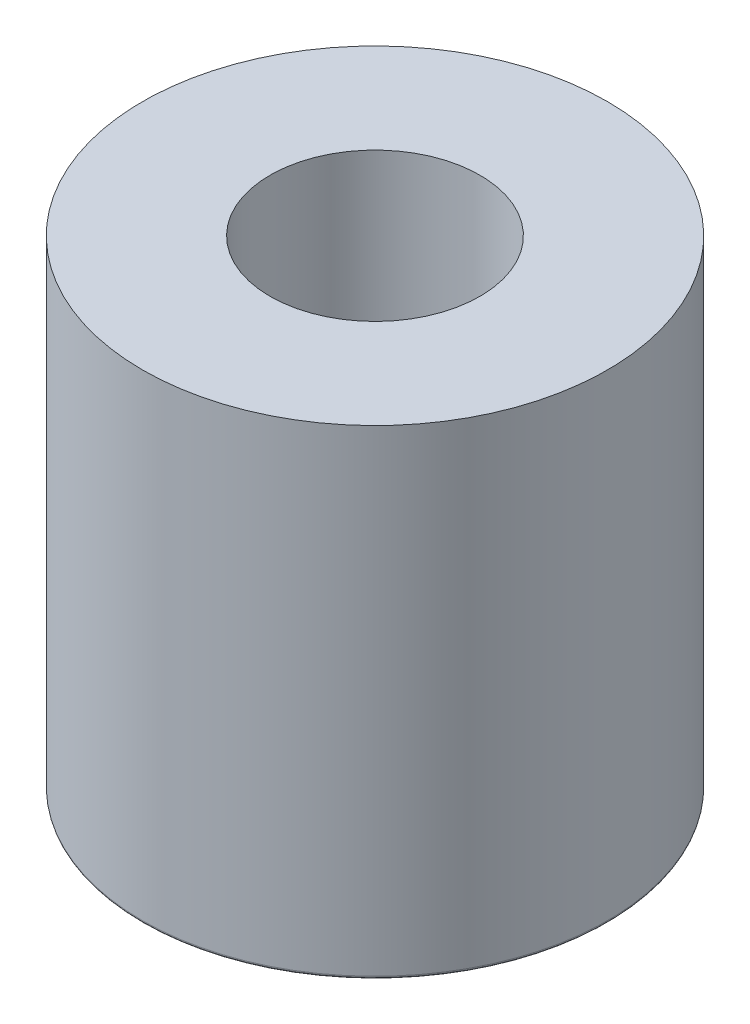
from build123d import *

# Parameters (mm, degrees)
SKETCH1_R            = 3
BOSS_EXTRUDE1_DEPTH  = 4.5
SKETCH2_R            = 4
BOSS_EXTRUDE3_DEPTH  = 5.7
SKETCH3_R            = 3.875
BOSS_EXTRUDE4_DEPTH  = 6
SKETCH4_R            = 1.75
CUT_EXTRUDE1_DEPTH   = 15
SKETCH27_W           = 0.2
SKETCH27_H           = 2
BOSS_EXTRUDE11_DEPTH = 0.1
SKETCH28_W           = 2
SKETCH28_H           = 0.32
SKETCH28_W_2         = 0.260444828
SKETCH28_H_2         = 2
CUT_EXTRUDE12_DEPTH  = 2
SKETCH30_R           = 0.75
BOSS_EXTRUDE12_DEPTH = 0.25
FILLET1_R            = 0.05


with BuildPart() as part:
    # Sketch1 → Boss-Extrude1 (new body)
    with BuildSketch(Plane(origin=(0, 0, 0), x_dir=(1, 0, 0), z_dir=(0, 1, 0))):
        with Locations(Location((0, 0, 0), (0, 0, 270))):
            Circle(SKETCH1_R)
    extrude(amount=BOSS_EXTRUDE1_DEPTH)

    # Sketch2 → Boss-Extrude3 (add)
    with BuildSketch(Plane.XZ):
        with Locations(Location((0, 0, 0), (0, 0, 270))):
            Circle(SKETCH2_R)
    extrude(amount=BOSS_EXTRUDE3_DEPTH)

    # Sketch3 → Boss-Extrude4 (add)
    with BuildSketch(Plane.XZ.offset(5.7)):
        with Locations(Location((0, 0, 0), (0, 0, 270))):
            Circle(SKETCH3_R)
    extrude(amount=BOSS_EXTRUDE4_DEPTH)

    # Sketch4 → Cut-Extrude1 (cut)
    with BuildSketch(Plane(origin=(0, 4.5, 0), x_dir=(1, 0, 0), z_dir=(0, 1, 0))):
        with Locations(Location((0, 0, 0), (0, 0, 270))):
            Circle(SKETCH4_R)
    extrude(amount=-CUT_EXTRUDE1_DEPTH, mode=Mode.SUBTRACT)

    # Sketch27 → Boss-Extrude11 (add)
    with BuildSketch(Plane.XZ.offset(11.7)):
        with Locations((2.8, 0)):
            Rectangle(SKETCH27_W, SKETCH27_H)
        with Locations((2.339555172, 0)):
            Rectangle(SKETCH27_W, SKETCH27_H)
        with Locations((-2.339555172, 0)):
            Rectangle(SKETCH27_W, SKETCH27_H)
        with Locations((-2.8, 0)):
            Rectangle(SKETCH27_W, SKETCH27_H)
        with BuildLine():
            Line((-1.908396934, -0.943010701), (-1.908396934, -0.761683842))
            Line((-1.908396934, -0.761683842), (-1.838655835, -0.761683842))
            Line((-1.838655835, -0.761683842), (-1.838655835, -0.776503826))
            Line((-1.838655835, -0.776503826), (-1.838655835, -0.830771119))
            add(Edge.make_bspline(
                [(-1.838655835, -0.830771119), (-1.838021547, -0.835916193), (-1.836810122, -0.84574276), (-1.831239264, -0.859153688), (-1.823718107, -0.870971548), (-1.816538568, -0.876711781), (-1.812938804, -0.879589889)],
                knots=[0, 0, 0, 0, 1.086961345, 2.075985289, 3.035314294, 4, 4, 4, 4], degree=3))
            add(Edge.make_bspline(
                [(-1.812938804, -0.879589889), (-1.807197469, -0.883553117), (-1.795673797, -0.891507875), (-1.777056112, -0.901422138), (-1.757611843, -0.909973641), (-1.737267891, -0.916954625), (-1.716058386, -0.922383654), (-1.693927517, -0.926386741), (-1.670808067, -0.928456453), (-1.655080396, -0.928858244), (-1.647085752, -0.929062481)],
                knots=[0, 0, 0, 0, 0.950794876, 1.908379761, 2.871127693, 3.84558135, 4.838051937, 5.854515109, 6.909413221, 8, 8, 8, 8], degree=3))
            add(Edge.make_bspline(
                [(-1.647085752, -0.929062481), (-1.639293233, -0.928910482), (-1.624049824, -0.928613147), (-1.601809485, -0.924582791), (-1.580553112, -0.918946859), (-1.560650123, -0.910270037), (-1.541881954, -0.899431027), (-1.52408284, -0.886381737), (-1.507818369, -0.870457949), (-1.492548461, -0.852656017), (-1.478817925, -0.832788909), (-1.466937581, -0.811185656), (-1.456516224, -0.788152961), (-1.448342065, -0.763515049), (-1.442029559, -0.737402074), (-1.437518578, -0.709865547), (-1.434566736, -0.680819345), (-1.434296001, -0.660929981), (-1.434157457, -0.650751905)],
                knots=[0, 0, 0, 0, 0.951078584, 1.860461359, 2.754456427, 3.633511994, 4.504639864, 5.399648457, 6.322754807, 7.280029946, 8.262743676, 9.268295822, 10.289716263, 11.348243062, 12.435753816, 13.569926378, 14.756447268, 16, 16, 16, 16], degree=3))
            add(Edge.make_bspline(
                [(-1.434157457, -0.650751905), (-1.434306261, -0.640566361), (-1.434595383, -0.620776264), (-1.438580046, -0.592007726), (-1.444200831, -0.56483566), (-1.452862965, -0.539490895), (-1.463493336, -0.515740442), (-1.476715476, -0.493706921), (-1.492397245, -0.473464666), (-1.510464949, -0.455065867), (-1.530383529, -0.43847725), (-1.552461885, -0.424339702), (-1.576049431, -0.411912379), (-1.601820273, -0.402269075), (-1.629253141, -0.394308728), (-1.658616939, -0.38901978), (-1.689722979, -0.385652639), (-1.711078408, -0.385275695), (-1.722057434, -0.385081904)],
                knots=[0, 0, 0, 0, 1.099532391, 2.136346529, 3.132402078, 4.09294242, 5.023778189, 5.93909755, 6.862224401, 7.783581112, 8.720189817, 9.656305093, 10.611152675, 11.595042726, 12.623564843, 13.693451414, 14.814181828, 16, 16, 16, 16], degree=3))
            Line((-1.722057434, -0.385081904), (-1.810759395, -0.385081904))
            Line((-1.810759395, -0.385081904), (-1.810759395, -0.343237244))
            Line((-1.810759395, -0.343237244), (-1.765209739, -0.343237244))
            add(Edge.make_bspline(
                [(-1.765209739, -0.343237244), (-1.752998571, -0.343102125), (-1.729339965, -0.342840337), (-1.695212452, -0.339928256), (-1.663579195, -0.335485783), (-1.634644745, -0.328989338), (-1.608190922, -0.320742593), (-1.584418679, -0.310574856), (-1.563161165, -0.298495532), (-1.544463872, -0.284457138), (-1.528012028, -0.268334598), (-1.514130541, -0.249869425), (-1.502079898, -0.229317386), (-1.492764276, -0.206331821), (-1.484900774, -0.181312208), (-1.47997467, -0.15392597), (-1.476546412, -0.124438906), (-1.47618749, -0.104021817), (-1.476002117, -0.093476931)],
                knots=[0, 0, 0, 0, 1.326177627, 2.569411233, 3.717833407, 4.793796475, 5.787145267, 6.723897738, 7.597025505, 8.436701517, 9.257018564, 10.090403663, 10.939080149, 11.837519171, 12.778616236, 13.783093849, 14.85502659, 16, 16, 16, 16], degree=3))
            add(Edge.make_bspline(
                [(-1.476002117, -0.093476931), (-1.476078632, -0.084389663), (-1.476227062, -0.066761662), (-1.478765722, -0.04122112), (-1.482439234, -0.017425105), (-1.48722232, 0.004696519), (-1.494195665, 0.024869784), (-1.502065114, 0.043467257), (-1.511752165, 0.060214239), (-1.522939667, 0.075070847), (-1.535427641, 0.088439117), (-1.549773508, 0.099662846), (-1.56520781, 0.109614745), (-1.582308979, 0.117527471), (-1.600837402, 0.123547317), (-1.620840029, 0.127897868), (-1.642292776, 0.130541295), (-1.657103229, 0.130845432), (-1.664738968, 0.131002233)],
                knots=[0, 0, 0, 0, 1.298576519, 2.519052765, 3.664770883, 4.740572896, 5.748834366, 6.711621253, 7.623665698, 8.506443527, 9.365943911, 10.230449435, 11.103459615, 11.986237445, 12.915678043, 13.883325969, 14.908718741, 16, 16, 16, 16], degree=3))
            add(Edge.make_bspline(
                [(-1.664738968, 0.131002233), (-1.67784524, 0.130526544), (-1.703438858, 0.12959763), (-1.740732634, 0.122761472), (-1.775666181, 0.111132669), (-1.796953621, 0.099640541), (-1.807490281, 0.093952274)],
                knots=[0, 0, 0, 0, 1.053593617, 2.057432638, 3.038486015, 4, 4, 4, 4], degree=3))
            add(Edge.make_bspline(
                [(-1.807490281, 0.093952274), (-1.810088501, 0.092210607), (-1.814950991, 0.088951131), (-1.821101998, 0.083139695), (-1.825492509, 0.076837637), (-1.827957847, 0.070864107), (-1.82896566, 0.064898921), (-1.830118265, 0.058383038), (-1.831140929, 0.049648596), (-1.83216549, 0.038811152), (-1.833497444, 0.025881893), (-1.83506575, 0.010855197), (-1.836567109, -0.00636584), (-1.837505226, -0.01857699), (-1.838002012, -0.025043477)],
                knots=[0, 0, 0, 0, 0.879812501, 1.646542448, 2.36713564, 3.028064192, 3.445270561, 4.067391947, 4.891968434, 5.919830777, 7.132913586, 8.551568617, 10.17386271, 12, 12, 12, 12], degree=3))
            Line((-1.838002012, -0.025043477), (-1.838655835, -0.036376406))
            Line((-1.838655835, -0.036376406), (-1.908396934, -0.036376406))
            Line((-1.908396934, -0.036376406), (-1.908396934, 0.131002233))
            add(Edge.make_bspline(
                [(-1.908396934, 0.131002233), (-1.898550001, 0.13437677), (-1.878646983, 0.141197519), (-1.847908762, 0.149565652), (-1.816215174, 0.156811768), (-1.783553892, 0.162648666), (-1.74996162, 0.167226055), (-1.715425458, 0.170473678), (-1.67994622, 0.172480178), (-1.65595134, 0.172723726), (-1.643816638, 0.172846893)],
                knots=[0, 0, 0, 0, 0.92788875, 1.875486081, 2.838716749, 3.825932113, 4.832674024, 5.860695322, 6.918109807, 8, 8, 8, 8], degree=3))
            add(Edge.make_bspline(
                [(-1.643816638, 0.172846893), (-1.631753181, 0.172615356), (-1.608167877, 0.172162677), (-1.573747833, 0.169292393), (-1.541349636, 0.163586566), (-1.510746208, 0.15674302), (-1.482309856, 0.146968928), (-1.455716928, 0.135420802), (-1.431009593, 0.12176997), (-1.408574864, 0.105737441), (-1.388236965, 0.088249419), (-1.370682213, 0.068871319), (-1.355689517, 0.048108316), (-1.34366719, 0.025637126), (-1.334181351, 0.001658913), (-1.327558924, -0.023889029), (-1.323210204, -0.050903055), (-1.322787675, -0.069413302), (-1.322571697, -0.078874888)],
                knots=[0, 0, 0, 0, 1.258520905, 2.460538288, 3.597972764, 4.687969455, 5.728008804, 6.729052755, 7.709461579, 8.666154017, 9.600741666, 10.501983938, 11.387315295, 12.265482606, 13.153437077, 14.070658611, 15.013809414, 16, 16, 16, 16], degree=3))
            add(Edge.make_bspline(
                [(-1.322571697, -0.078874888), (-1.322721978, -0.086875425), (-1.323016545, -0.102557474), (-1.325847694, -0.125620899), (-1.329727078, -0.147863886), (-1.336077699, -0.16913008), (-1.343596679, -0.189680622), (-1.352968934, -0.209332841), (-1.364240242, -0.228013573), (-1.377125732, -0.245816969), (-1.391463512, -0.263032), (-1.408057724, -0.278794585), (-1.425904751, -0.294264449), (-1.445797144, -0.308484139), (-1.467225192, -0.322085615), (-1.490447204, -0.334751226), (-1.515442732, -0.34646662), (-1.532919728, -0.353424213), (-1.541820279, -0.356967523)],
                knots=[0, 0, 0, 0, 1.010174578, 1.980067854, 2.9322583, 3.858806069, 4.779334862, 5.694725609, 6.604440247, 7.531533258, 8.469240029, 9.429752861, 10.419204571, 11.450869805, 12.515124691, 13.624026854, 14.789982478, 16, 16, 16, 16], degree=3))
            add(Edge.make_bspline(
                [(-1.541820279, -0.356967523), (-1.530525942, -0.359973096), (-1.508573741, -0.365814867), (-1.477131497, -0.376285638), (-1.44823989, -0.387859744), (-1.421669244, -0.399927541), (-1.397778261, -0.413293344), (-1.376381103, -0.427609443), (-1.357500245, -0.442950495), (-1.340897058, -0.459206508), (-1.326505479, -0.476859539), (-1.314286596, -0.496238375), (-1.303807991, -0.517176081), (-1.295299201, -0.539750294), (-1.288774516, -0.563996694), (-1.284029397, -0.589865309), (-1.281149709, -0.617414207), (-1.28087022, -0.63628806), (-1.280727038, -0.645957205)],
                knots=[0, 0, 0, 0, 1.307709712, 2.541725736, 3.705678368, 4.789627241, 5.805103324, 6.765658399, 7.667149594, 8.523715164, 9.361715189, 10.209711591, 11.08229269, 11.977677995, 12.904617173, 13.888456662, 14.918248446, 16, 16, 16, 16], degree=3))
            add(Edge.make_bspline(
                [(-1.280727038, -0.645957205), (-1.281011775, -0.658102889), (-1.281569724, -0.681902619), (-1.286170963, -0.716593579), (-1.293912579, -0.749314883), (-1.304147598, -0.780243586), (-1.318199718, -0.808941347), (-1.334690037, -0.836044305), (-1.354747009, -0.860869644), (-1.377378491, -0.883824094), (-1.402732401, -0.904267957), (-1.430284624, -0.922255285), (-1.460113676, -0.937345636), (-1.492145221, -0.949519185), (-1.526288572, -0.959096117), (-1.562512783, -0.966024696), (-1.600926435, -0.970261545), (-1.627241901, -0.97068799), (-1.640765464, -0.970907141)],
                knots=[0, 0, 0, 0, 1.063396629, 2.083748558, 3.057496812, 4.005101803, 4.929900845, 5.849762909, 6.777773259, 7.718002778, 8.667890207, 9.624317239, 10.594546725, 11.589390339, 12.620593392, 13.696138762, 14.816041693, 16, 16, 16, 16], degree=3))
            add(Edge.make_bspline(
                [(-1.640765464, -0.970907141), (-1.665547803, -0.970590031), (-1.713572744, -0.969975513), (-1.783078247, -0.964768651), (-1.84765939, -0.956029439), (-1.888609394, -0.947252045), (-1.908396934, -0.943010701)],
                knots=[0, 0, 0, 0, 1.102689383, 2.136868281, 3.099712061, 4, 4, 4, 4], degree=3))
        make_face()
        with BuildLine():
            Line((1.285745429, -0.943010701), (1.285745429, -0.871090192))
            add(Edge.make_bspline(
                [(1.285745429, -0.871090192), (1.290817697, -0.855922684), (1.300862472, -0.825885981), (1.318549399, -0.782265171), (1.338421607, -0.740493709), (1.360496544, -0.700598242), (1.384418732, -0.662405973), (1.410483422, -0.626097087), (1.438544309, -0.591486708), (1.459007071, -0.569982657), (1.469251698, -0.559216712)],
                knots=[0, 0, 0, 0, 1.050700464, 2.080735854, 3.090676239, 4.088449864, 5.075142831, 6.050126928, 7.023801348, 8, 8, 8, 8], degree=3))
            Line((1.469251698, -0.559216712), (1.547710435, -0.485770617))
            add(Edge.make_bspline(
                [(1.547710435, -0.485770617), (1.558566619, -0.475560978), (1.579564482, -0.455813652), (1.609365802, -0.426758604), (1.636252122, -0.39914908), (1.6605068, -0.373387401), (1.681644475, -0.348952816), (1.699961591, -0.326221502), (1.715864536, -0.305447257), (1.728765548, -0.285556615), (1.739740403, -0.266256293), (1.748911677, -0.246575598), (1.756566149, -0.226153986), (1.762835967, -0.205023667), (1.767935204, -0.183208884), (1.77130224, -0.160683477), (1.773639902, -0.137477707), (1.773834317, -0.121742684), (1.773933127, -0.113745438)],
                knots=[0, 0, 0, 0, 1.588062519, 3.071606111, 4.434729839, 5.694510104, 6.841517844, 7.876435956, 8.805403746, 9.627779299, 10.400757042, 11.169614695, 11.938861978, 12.722618816, 13.516970778, 14.32389783, 15.148129558, 16, 16, 16, 16], degree=3))
            add(Edge.make_bspline(
                [(1.773933127, -0.113745438), (1.773769741, -0.104731571), (1.773450154, -0.087100235), (1.770843417, -0.061369211), (1.766356383, -0.037014188), (1.760776921, -0.013909912), (1.752610948, 0.007598774), (1.743485651, 0.028017323), (1.731925536, 0.046750913), (1.719187534, 0.064247349), (1.704860661, 0.07989689), (1.68924603, 0.093500113), (1.672658689, 0.105186418), (1.654812956, 0.114557175), (1.635935057, 0.122112202), (1.615859276, 0.127245575), (1.594665734, 0.130369231), (1.580194712, 0.130787656), (1.572773643, 0.131002233)],
                knots=[0, 0, 0, 0, 1.214385169, 2.375366155, 3.479367376, 4.550061153, 5.571993571, 6.574904148, 7.558619874, 8.531612115, 9.487667638, 10.410319034, 11.317260121, 12.214909893, 13.1201062, 14.050770688, 15.000390762, 16, 16, 16, 16], degree=3))
            add(Edge.make_bspline(
                [(1.572773643, 0.131002233), (1.564558218, 0.130827696), (1.548455201, 0.130485586), (1.524790945, 0.128005969), (1.502037171, 0.124158381), (1.480209296, 0.118537632), (1.459517101, 0.11101856), (1.439693084, 0.102307518), (1.420850107, 0.091918984), (1.40923876, 0.0835396), (1.403433535, 0.079350232)],
                knots=[0, 0, 0, 0, 1.093988183, 2.144321298, 3.165507317, 4.165200079, 5.141442069, 6.094343835, 7.047245601, 8, 8, 8, 8], degree=3))
            add(Edge.make_bspline(
                [(1.403433535, 0.079350232), (1.401209509, 0.077264462), (1.396261358, 0.072623912), (1.39085434, 0.062454748), (1.38556733, 0.049596568), (1.381528162, 0.03331899), (1.377547234, 0.014150332), (1.374380978, -0.008202729), (1.3717883, -0.033648466), (1.370675555, -0.051699564), (1.370088572, -0.061221672)],
                knots=[0, 0, 0, 0, 0.494504152, 1.100203551, 1.855075106, 2.763546905, 3.828066112, 5.049912925, 6.443803704, 8, 8, 8, 8], degree=3))
            Line((1.370088572, -0.061221672), (1.369434749, -0.078221066))
            Line((1.369434749, -0.078221066), (1.299693649, -0.078221066))
            Line((1.299693649, -0.078221066), (1.299693649, 0.103105794))
            add(Edge.make_bspline(
                [(1.299693649, 0.103105794), (1.312721133, 0.108676405), (1.338345704, 0.119633588), (1.376870396, 0.133665232), (1.414492468, 0.145806353), (1.451370052, 0.155641723), (1.487456606, 0.16327022), (1.522734089, 0.168772479), (1.557159215, 0.172188715), (1.579885642, 0.172629676), (1.591080681, 0.172846893)],
                knots=[0, 0, 0, 0, 1.126844811, 2.216461464, 3.259975363, 4.270602231, 5.25095513, 6.192474031, 7.109612608, 8, 8, 8, 8], degree=3))
            add(Edge.make_bspline(
                [(1.591080681, 0.172846893), (1.603075001, 0.172577223), (1.626613451, 0.172048005), (1.6611357, 0.168441945), (1.693962209, 0.161757778), (1.725249898, 0.152966795), (1.75474905, 0.141302604), (1.782742424, 0.127352069), (1.808847321, 0.110462347), (1.833207838, 0.091413566), (1.855122756, 0.070327136), (1.874512822, 0.047780231), (1.89091616, 0.023749524), (1.904391701, -0.001736747), (1.914574646, -0.028721547), (1.922085037, -0.057034069), (1.926458262, -0.086802625), (1.927058415, -0.107120431), (1.927363546, -0.117450434)],
                knots=[0, 0, 0, 0, 1.157424332, 2.271406417, 3.343739353, 4.38656673, 5.403242917, 6.40017594, 7.399668867, 8.398153384, 9.37981207, 10.329487603, 11.262773791, 12.181519608, 13.104561084, 14.039740884, 15.003362774, 16, 16, 16, 16], degree=3))
            add(Edge.make_bspline(
                [(1.927363546, -0.117450434), (1.927177392, -0.124503273), (1.926805955, -0.138575947), (1.924377561, -0.159577885), (1.920221024, -0.180350705), (1.914314049, -0.200905884), (1.90662216, -0.221189762), (1.897362959, -0.241308903), (1.886777894, -0.261481491), (1.874006666, -0.281210063), (1.859819031, -0.300847352), (1.844096076, -0.320397936), (1.826390107, -0.339455523), (1.807099713, -0.358399732), (1.786507389, -0.377554793), (1.763658714, -0.395779542), (1.739740278, -0.414617865), (1.722712188, -0.426364598), (1.71399937, -0.432375087)],
                knots=[0, 0, 0, 0, 0.854554074, 1.705109362, 2.55789356, 3.41877106, 4.293443476, 5.183657085, 6.101173272, 7.051052993, 8.028272964, 9.035940767, 10.088733311, 11.177986928, 12.311886033, 13.494190071, 14.717844033, 16, 16, 16, 16], degree=3))
            Line((1.71399937, -0.432375087), (1.630745932, -0.494706195))
            add(Edge.make_bspline(
                [(1.630745932, -0.494706195), (1.614782308, -0.506959249), (1.583845168, -0.530705388), (1.542096786, -0.569227964), (1.505937277, -0.608468121), (1.475317006, -0.648486184), (1.450433266, -0.689439492), (1.431302326, -0.731233361), (1.417810219, -0.773943377), (1.413449163, -0.803013486), (1.411279409, -0.817476722)],
                knots=[0, 0, 0, 0, 1.201871832, 2.329200212, 3.389066614, 4.38652552, 5.334876373, 6.24585856, 7.12726292, 8, 8, 8, 8], degree=3))
            Line((1.411279409, -0.817476722), (1.927363546, -0.817476722))
            Line((1.927363546, -0.817476722), (1.927363546, -0.943010701))
            Line((1.927363546, -0.943010701), (1.285745429, -0.943010701))
        make_face()
        with BuildLine():
            Line((0.079877546, 2.049550032), (0.079877546, 1.128967516))
            add(Edge.make_bspline(
                [(0.079877546, 1.128967516), (0.079950394, 1.118577452), (0.080086987, 1.099095596), (0.081348665, 1.071829087), (0.083460114, 1.048397076), (0.086324085, 1.028855634), (0.09016785, 1.013076592), (0.094690249, 1.001234786), (0.100273411, 0.992562385), (0.105463441, 0.989980792), (0.107773986, 0.988831494)],
                knots=[0, 0, 0, 0, 1.690351743, 3.169488472, 4.43968455, 5.516231434, 6.381963372, 7.071151893, 7.586486888, 8, 8, 8, 8], degree=3))
            add(Edge.make_bspline(
                [(0.107773986, 0.988831494), (0.123396945, 0.985181041), (0.154728304, 0.977860169), (0.18688965, 0.976893509), (0.203014175, 0.976408861)],
                knots=[0, 0, 0, 0, 0.997272949, 2, 2, 2, 2], degree=3))
            Line((0.203014175, 0.976408861), (0.289100845, 0.975537097))
            Line((0.289100845, 0.975537097), (0.289100845, 0.933692437))
            Line((0.289100845, 0.933692437), (-0.268827952, 0.933692437))
            Line((-0.268827952, 0.933692437), (-0.268827952, 0.975537097))
            Line((-0.268827952, 0.975537097), (-0.182741282, 0.976408861))
            add(Edge.make_bspline(
                [(-0.182741282, 0.976408861), (-0.166616756, 0.976893509), (-0.134455411, 0.977860169), (-0.103124051, 0.985181041), (-0.087501093, 0.988831494)],
                knots=[0, 0, 0, 0, 1.002727051, 2, 2, 2, 2], degree=3))
            add(Edge.make_bspline(
                [(-0.087501093, 0.988831494), (-0.085190548, 0.989980792), (-0.080000518, 0.992562385), (-0.074417356, 1.001234786), (-0.069894957, 1.013076592), (-0.066051191, 1.028855634), (-0.06318722, 1.048397076), (-0.061075772, 1.071829087), (-0.059814094, 1.099095596), (-0.059677501, 1.118577452), (-0.059604653, 1.128967516)],
                knots=[0, 0, 0, 0, 0.413513112, 0.928848107, 1.618036628, 2.483768566, 3.56031545, 4.830511528, 6.309648257, 8, 8, 8, 8], degree=3))
            Line((-0.059604653, 1.128967516), (-0.059604653, 1.836621737))
            add(Edge.make_bspline(
                [(-0.059604653, 1.836621737), (-0.059657938, 1.847665411), (-0.059755809, 1.867949572), (-0.061167054, 1.895748731), (-0.063696234, 1.918171313), (-0.066903954, 1.935744478), (-0.071710536, 1.948948197), (-0.077677937, 1.958552919), (-0.085643549, 1.964953349), (-0.091832438, 1.965559289), (-0.094911085, 1.965860712)],
                knots=[0, 0, 0, 0, 1.845346783, 3.389389205, 4.648203411, 5.614791506, 6.367825088, 6.980593719, 7.492898928, 8, 8, 8, 8], degree=3))
            add(Edge.make_bspline(
                [(-0.094911085, 1.965860712), (-0.097091626, 1.965809043), (-0.102041242, 1.965691759), (-0.110322806, 1.964950358), (-0.120370351, 1.963934754), (-0.132094268, 1.961998119), (-0.145658283, 1.960228498), (-0.160788288, 1.957423484), (-0.177762829, 1.954722139), (-0.189576199, 1.952455983), (-0.195817738, 1.951258669)],
                knots=[0, 0, 0, 0, 0.512851578, 1.16412313, 1.954688223, 2.887378464, 3.957785934, 5.171221834, 6.505428207, 8, 8, 8, 8], degree=3))
            Line((-0.195817738, 1.951258669), (-0.268827952, 1.937964272))
            Line((-0.268827952, 1.937964272), (-0.268827952, 1.979808932))
            Line((-0.268827952, 1.979808932), (0.079877546, 2.049550032))
        make_face()
    extrude(amount=BOSS_EXTRUDE11_DEPTH)

    # Sketch28 → Cut-Extrude12 (cut)
    with BuildSketch(Plane.XZ.offset(11.7)):
        with Locations((0, 2.425)):
            Rectangle(SKETCH28_W, SKETCH28_H)
        with Locations((2.569777586, 0)):
            Rectangle(SKETCH28_W_2, SKETCH28_H_2)
        with Locations((-2.569777586, 0)):
            Rectangle(SKETCH28_W_2, SKETCH28_H_2)
    extrude(amount=-CUT_EXTRUDE12_DEPTH, mode=Mode.SUBTRACT)

    # Sketch29 → Cut-Revolve2 (revolve, cut)
    with BuildSketch(Plane.XY, mode=Mode.PRIVATE) as cut_revolve2_sk:
        Polygon((0, -3.7), (3.875, -3.7), (3.875, -5.7), (4.949378768, -5.7), (4.949378768, 6.289511207), (0, 6.289511207), align=None)
    revolve(cut_revolve2_sk.sketch.rotate(Axis((0, 0, 0), (0, -1, 0)), 90), axis=Axis((0, 0, 0), (0, -1, 0)), mode=Mode.SUBTRACT)

    # Sketch30 → Boss-Extrude12 (add)
    with BuildSketch(Plane(origin=(0, -10.5, 0), x_dir=(1, 0, 0), z_dir=(0, 1, 0))):
        with Locations(Location((0, 0, 0), (0, 0, 270))):
            Circle(SKETCH30_R)
    extrude(amount=BOSS_EXTRUDE12_DEPTH)

    # Fillet1
    fillet1_edges = [part.edges().sort_by_distance(p)[0] for p in [
        (0, -11.7, 3.875),
    ]]
    fillet(fillet1_edges, radius=FILLET1_R)


solid = part.part
